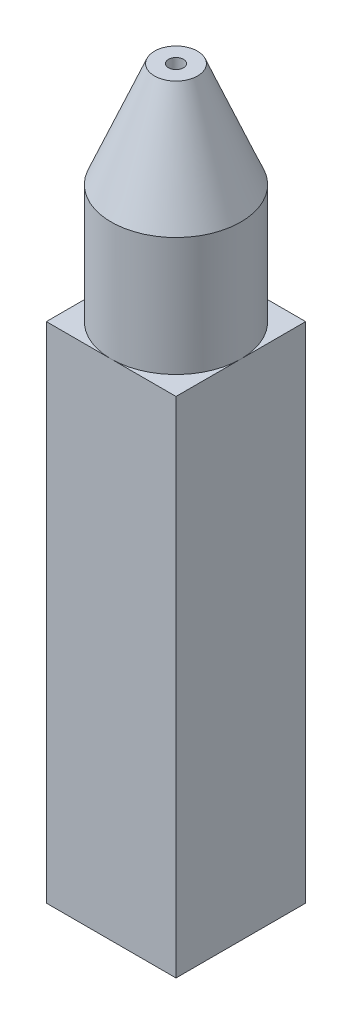
from build123d import *

# Parameters (mm, degrees)
BOSS_EXTRUDE2_START = -23.18385
BOSS_EXTRUDE2_DEPTH = 23.18385


with BuildPart() as part:
    # Sketch1 → Revolve1 (revolve)
    with BuildSketch(Plane.XY, mode=Mode.PRIVATE) as revolve1_sk:
        Polygon((-0.9906, 0), (-2.9845, 0), (-2.9845, 28.64485), (-0.9906, 33.47085), (-0.3429, 33.47085), (-0.3429, 9.31545), (-0.9906, 8.193600692), align=None)
    revolve(revolve1_sk.sketch.rotate(Axis((0, 0, 0), (0, 1, 0)), 270), axis=Axis((0, 0, 0), (0, 1, 0)))

    # Sketch2 → Boss-Extrude2 (add)
    with BuildSketch(Plane.XZ.offset(BOSS_EXTRUDE2_START)):
        with BuildLine():
            Line((2.9845, 2.9845), (-1e-09, 2.9845))
            ThreePointArc((-1e-09, 2.9845), (2.110360188, 2.110360189), (2.9845, 0))
            Line((2.9845, 0), (2.9845, 2.9845))
        make_face()
        with BuildLine():
            Line((-1e-09, 2.9845), (-2.9845, 2.9845))
            Line((-2.9845, 2.9845), (-2.9845, 5e-09))
            ThreePointArc((-2.9845, 5e-09), (-2.110360187, 2.11036019), (-1e-09, 2.9845))
        make_face()
        with BuildLine():
            Line((2.9845, -2.9845), (2.9845, 0))
            ThreePointArc((2.9845, 0), (2.110360188, -2.110360189), (-2e-09, -2.9845))
            Line((-2e-09, -2.9845), (2.9845, -2.9845))
        make_face()
        with BuildLine():
            ThreePointArc((-2e-09, -2.9845), (-2.110360191, -2.110360186), (-2.9845, 5e-09))
            Line((-2.9845, 5e-09), (-2.9845, -2.9845))
            Line((-2.9845, -2.9845), (-2e-09, -2.9845))
        make_face()
    extrude(amount=BOSS_EXTRUDE2_DEPTH)


solid = part.part
